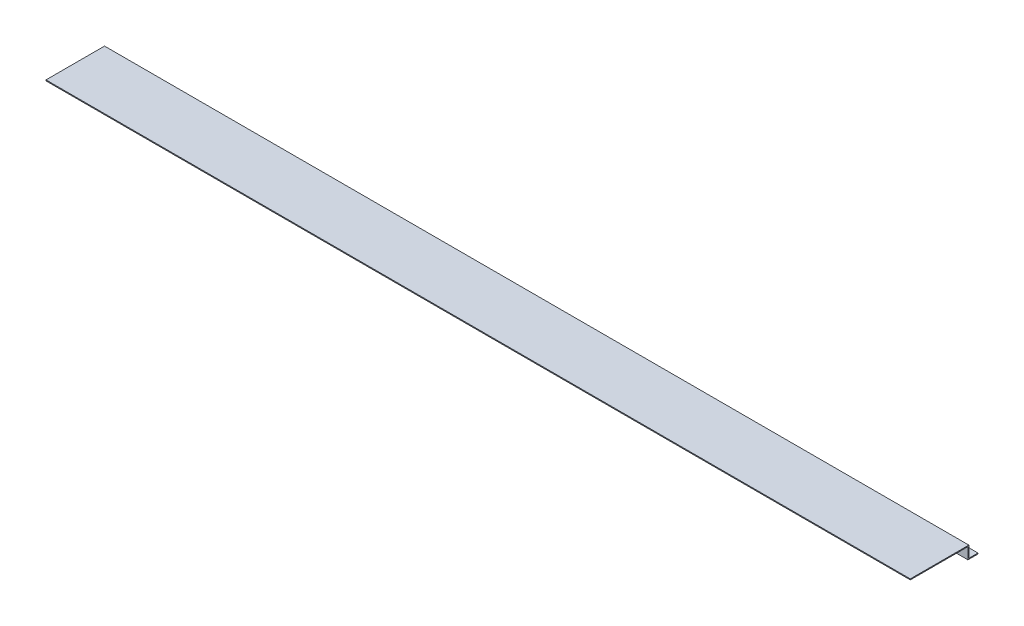
from build123d import *

# Parameters (mm, degrees)
BOSS_EXTRUDE2_DEPTH = 1890


with BuildPart() as part:
    # Sketch1 → Boss-Extrude2 (new body)
    with BuildSketch(Plane(origin=(0, 0, 0), x_dir=(0, 0, -1), z_dir=(1, 0, 0))):
        Polygon((0, 0), (128, 0), (128, -25), (148, -25), (148, -27), (126, -27), (126, -2), (0, -2), align=None)
    extrude(amount=BOSS_EXTRUDE2_DEPTH)


solid = part.part
